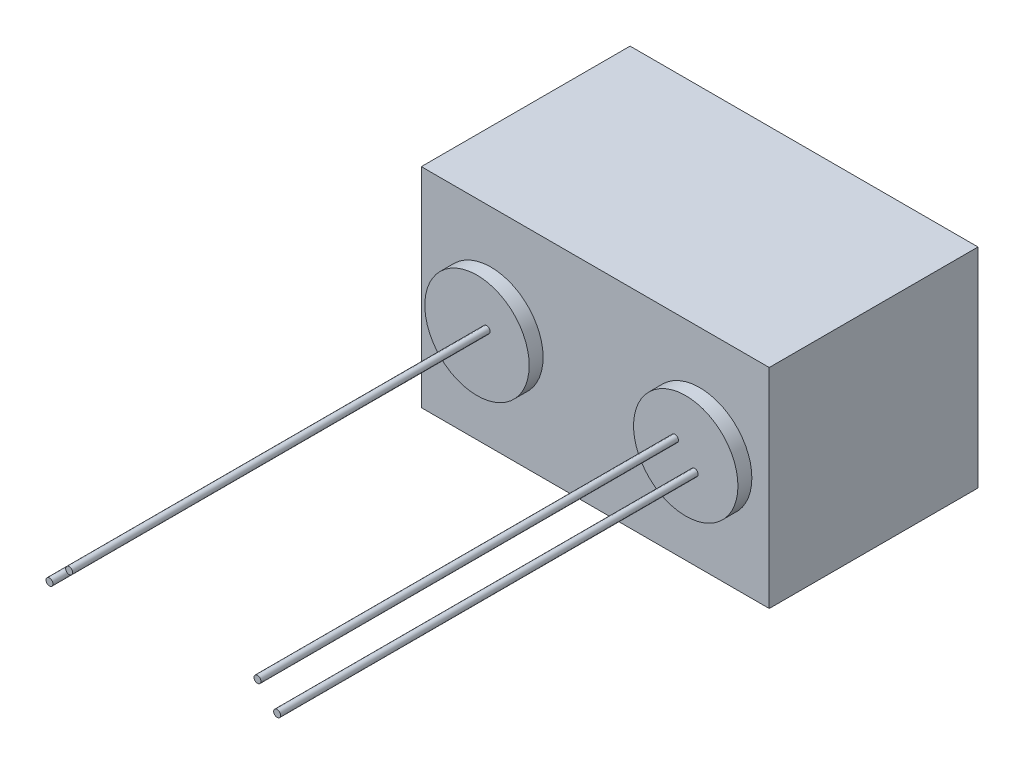
from build123d import *

# Parameters (mm, degrees)
SKETCH1_W           = 127
SKETCH1_H           = 76.2
BOSS_EXTRUDE1_DEPTH = 76.2
SKETCH2_R           = 19.05
BOSS_EXTRUDE2_DEPTH = 5.08
SKETCH3_R           = 1.27
BOSS_EXTRUDE3_DEPTH = 152.4


with BuildPart() as part:
    # Sketch1 → Boss-Extrude1 (new body)
    with BuildSketch(Plane.XY):
        Rectangle(SKETCH1_W, SKETCH1_H)
    extrude(amount=BOSS_EXTRUDE1_DEPTH)

    # Sketch2 → Boss-Extrude2 (add)
    with BuildSketch(Plane.XY.offset(76.2)):
        with Locations((38.1, 0)):
            Circle(SKETCH2_R)
        with Locations((-38.1, 0)):
            Circle(SKETCH2_R)
    extrude(amount=BOSS_EXTRUDE2_DEPTH)

    # Sketch3 → Boss-Extrude3 (add)
    with BuildSketch(Plane.XY.offset(81.28)):
        with Locations(Location((41.35063463, -3.592102448, 0), (0, 0, 180))):
            Circle(SKETCH3_R)
        with Locations(Location((34.166429733, 3.592102448, 0), (0, 0, 180))):
            Circle(SKETCH3_R)
        with Locations(Location((-41.755190332, -3.592102448, 0), (0, 0, 180))):
            Circle(SKETCH3_R)
        with Locations(Location((-34.570985435, 3.592102448, 0), (0, 0, 180))):
            Circle(SKETCH3_R)
    extrude(amount=BOSS_EXTRUDE3_DEPTH)


solid = part.part
